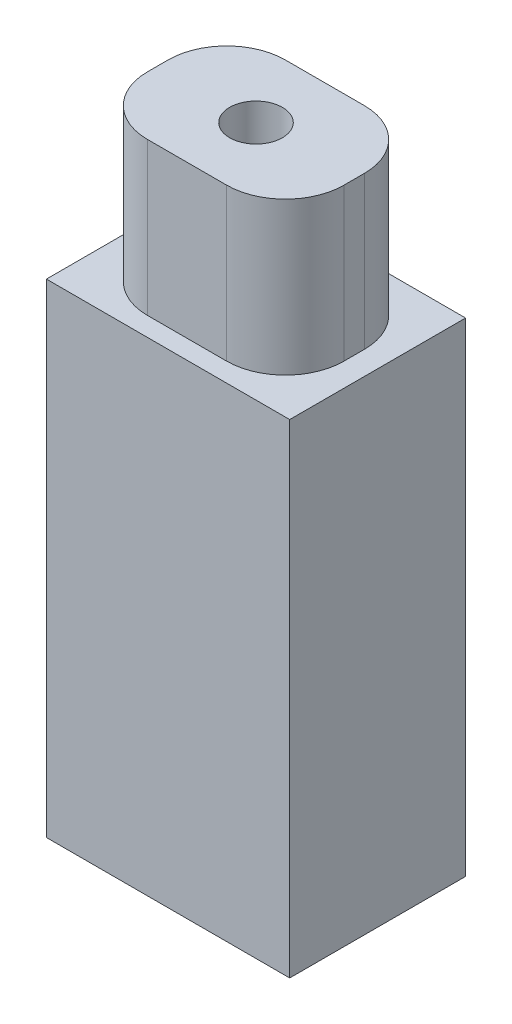
from build123d import *

# Parameters (mm, degrees)
SKETCH1_W           = 21.082
SKETCH1_H           = 41.91
BOSS_EXTRUDE1_DEPTH = 15.24
BOSS_EXTRUDE2_DEPTH = 13.208
SKETCH3_R           = 2.286
CUT_EXTRUDE1_DEPTH  = 10.16


with BuildPart() as part:
    # Sketch1 → Boss-Extrude1 (new body)
    with BuildSketch(Plane.XY):
        Rectangle(SKETCH1_W, SKETCH1_H)
    extrude(amount=BOSS_EXTRUDE1_DEPTH)

    # Sketch2 → Boss-Extrude2 (add)
    with BuildSketch(Plane(origin=(0, 20.955, 0), x_dir=(1, 0, 0), z_dir=(0, 1, 0))):
        with BuildLine():
            Line((3.429, -13.589), (-3.429, -13.589))
            ThreePointArc((-3.429, -13.589), (-7.021102448, -12.101102448), (-8.509, -8.509))
            Line((-8.509, -8.509), (-8.509, -6.731))
            ThreePointArc((-8.509, -6.731), (-7.021102448, -3.138897552), (-3.429, -1.651))
            Line((-3.429, -1.651), (3.429, -1.651))
            ThreePointArc((3.429, -1.651), (7.021102448, -3.138897552), (8.509, -6.731))
            Line((8.509, -6.731), (8.509, -8.509))
            ThreePointArc((8.509, -8.509), (7.021102448, -12.101102448), (3.429, -13.589))
        make_face()
    extrude(amount=BOSS_EXTRUDE2_DEPTH)

    # Sketch3 → Cut-Extrude1 (cut)
    with BuildSketch(Plane(origin=(0, 34.163, 0), x_dir=(1, 0, 0), z_dir=(0, 1, 0))):
        with Locations(Location((0, -7.62, 0), (0, 0, 270))):
            Circle(SKETCH3_R)
    extrude(amount=-CUT_EXTRUDE1_DEPTH, mode=Mode.SUBTRACT)


solid = part.part
